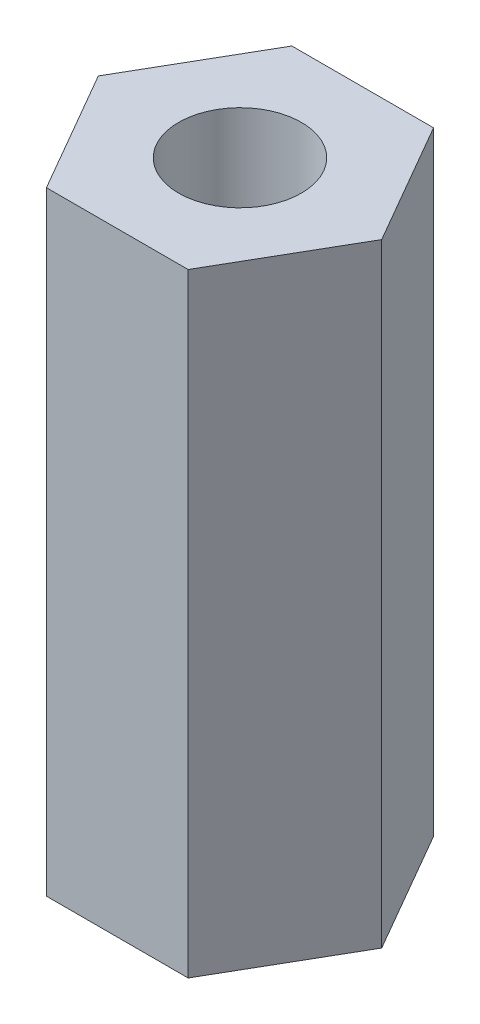
from build123d import *

# Parameters (mm, degrees)
SKETCH1_R           = 3.175
BOSS_EXTRUDE1_DEPTH = 31.75


with BuildPart() as part:
    # Sketch1 → Boss-Extrude1 (new body)
    with BuildSketch(Plane(origin=(0, 0, 0), x_dir=(1, 0, 0), z_dir=(0, 1, 0))):
        Polygon((-3.666174209, -6.35), (3.666174209, -6.35), (7.332348419, 0), (3.666174209, 6.35), (-3.666174209, 6.35), (-7.332348419, 0), align=None)
        with Locations(Location((0, 0, 0), (0, 0, 270))):
            Circle(SKETCH1_R, mode=Mode.SUBTRACT)
    extrude(amount=BOSS_EXTRUDE1_DEPTH)


solid = part.part
